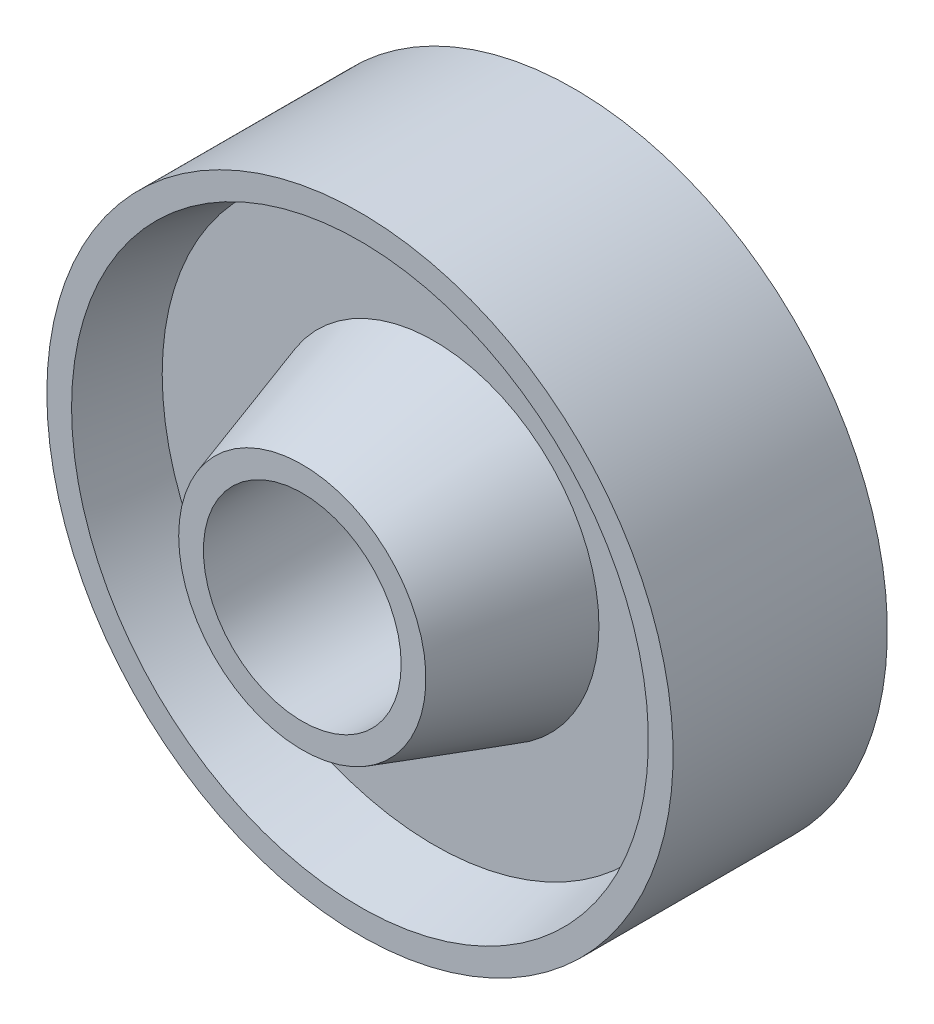
from build123d import *

# Parameters (mm, degrees)
SKETCH4_R          = 12
CUT_EXTRUDE1_DEPTH = 40


with BuildPart() as part:
    # Sketch3 → Revolve2 (revolve)
    with BuildSketch(Plane(origin=(0, 0, 0), x_dir=(1, 0, 0), z_dir=(0, 1, 0)), mode=Mode.PRIVATE) as revolve2_sk:
        Polygon((0, 20), (0, -20), (15, -20), (20, -4), (33, -4), (35, -13), (38, -13), (38, 13), (35, 13), (33, 4), (20, 4), (15, 20), align=None)
    revolve(revolve2_sk.sketch.rotate(Axis((0, 0, -47.350746269), (0, 0, 1)), 180), axis=Axis((0, 0, -47.350746269), (0, 0, 1)))

    # Sketch4 → Cut-Extrude1 (cut)
    with BuildSketch(Plane.XY.offset(20)):
        Circle(SKETCH4_R)
    extrude(amount=-CUT_EXTRUDE1_DEPTH, mode=Mode.SUBTRACT)


solid = part.part
